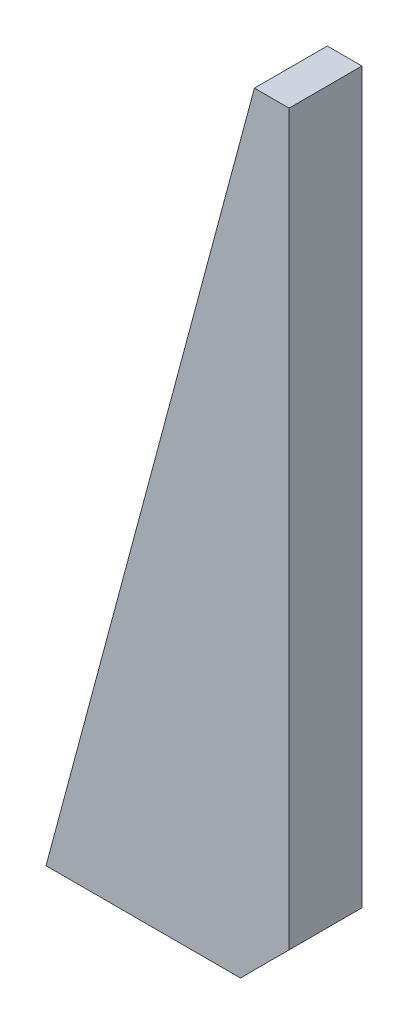
from build123d import *

# Parameters (mm, degrees)
EXTRUDE_1_DEPTH = 15


with BuildPart() as part:
    # 草圖1 → 填料-伸長1 (new body)
    with BuildSketch(Plane.XY):
        Polygon((0, 0), (42.871870789, 160), (50, 160), (50, 10), (40, 0), align=None)
    extrude(amount=EXTRUDE_1_DEPTH)


solid = part.part
